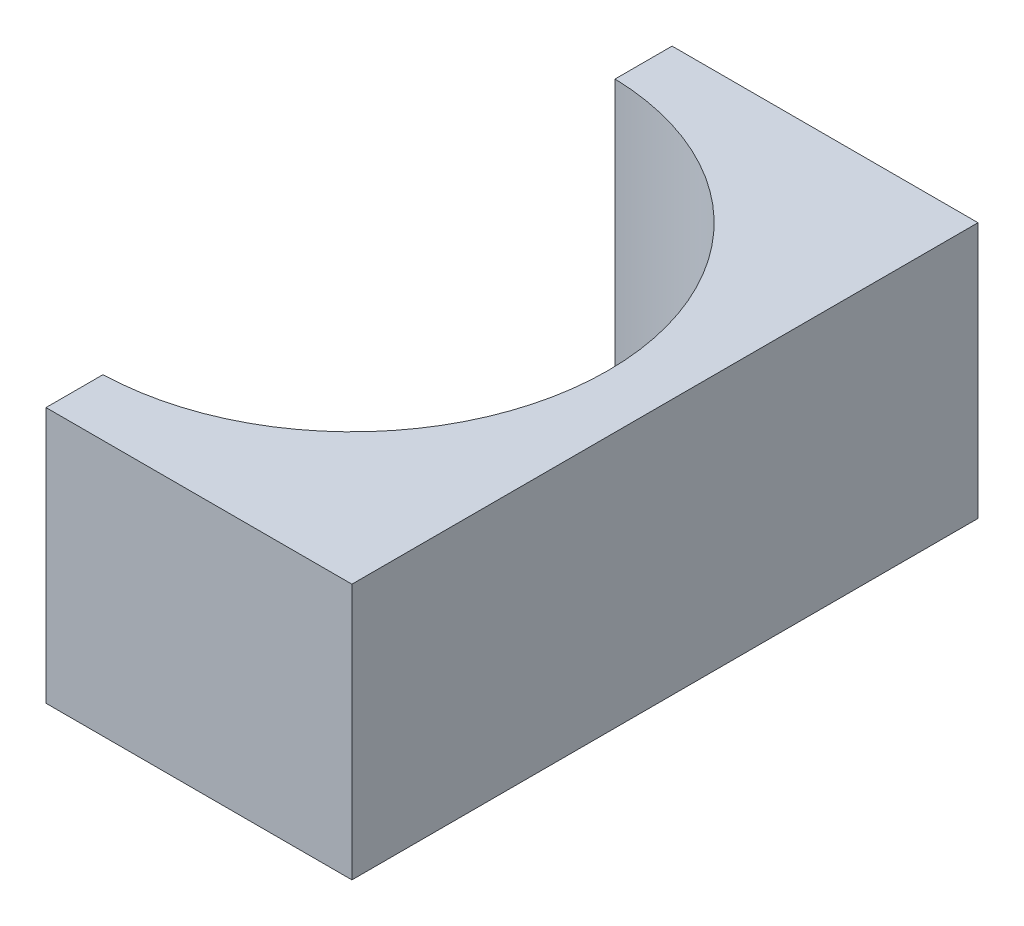
from build123d import *

# Parameters (mm, degrees)
BOSS_EXTRUDE1_DEPTH = 22.86


with BuildPart() as part:
    # Sketch1 → Boss-Extrude1 (new body)
    with BuildSketch(Plane(origin=(0, 0, 0), x_dir=(1, 0, 0), z_dir=(0, 1, 0))):
        with BuildLine():
            Line((0, 55.88), (0, 50.791178854))
            ThreePointArc((0, 50.791178854), (22.225, 27.94), (0, 5.088821146))
            Line((0, 5.088821146), (0, 0))
            Line((0, 0), (27.305, 0))
            Line((27.305, 0), (27.305, 55.88))
            Line((27.305, 55.88), (0, 55.88))
        make_face()
    extrude(amount=BOSS_EXTRUDE1_DEPTH)


solid = part.part
